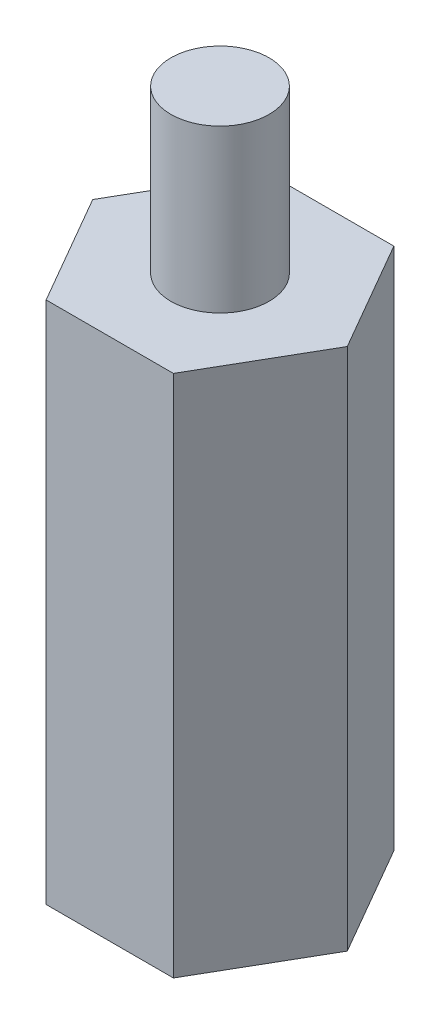
from build123d import *

# Parameters (mm, degrees)
BOSS_EXTRUDE1_DEPTH = 15.2
SKETCH2_R           = 1.425
BOSS_EXTRUDE2_DEPTH = 4.7
SKETCH3_R           = 1.425
CUT_EXTRUDE1_DEPTH  = 4


with BuildPart() as part:
    # Sketch1 → Boss-Extrude1 (new body)
    with BuildSketch(Plane(origin=(0, 0, 0), x_dir=(1, 0, 0), z_dir=(0, 1, 0))):
        Polygon((1.847520861, 3.2), (-1.847520861, 3.2), (-3.695041723, 0), (-1.847520861, -3.2), (1.847520861, -3.2), (3.695041723, 0), align=None)
    extrude(amount=BOSS_EXTRUDE1_DEPTH)

    # Sketch2 → Boss-Extrude2 (add)
    with BuildSketch(Plane(origin=(0, 15.2, 0), x_dir=(1, 0, 0), z_dir=(0, 1, 0))):
        with Locations(Location((0, 0, 0), (0, 0, 270))):
            Circle(SKETCH2_R)
    extrude(amount=BOSS_EXTRUDE2_DEPTH)

    # Sketch3 → Cut-Extrude1 (cut)
    with BuildSketch(Plane.XZ):
        with Locations(Location((0, 0, 0), (0, 0, 90))):
            Circle(SKETCH3_R)
    extrude(amount=-CUT_EXTRUDE1_DEPTH, mode=Mode.SUBTRACT)


solid = part.part
